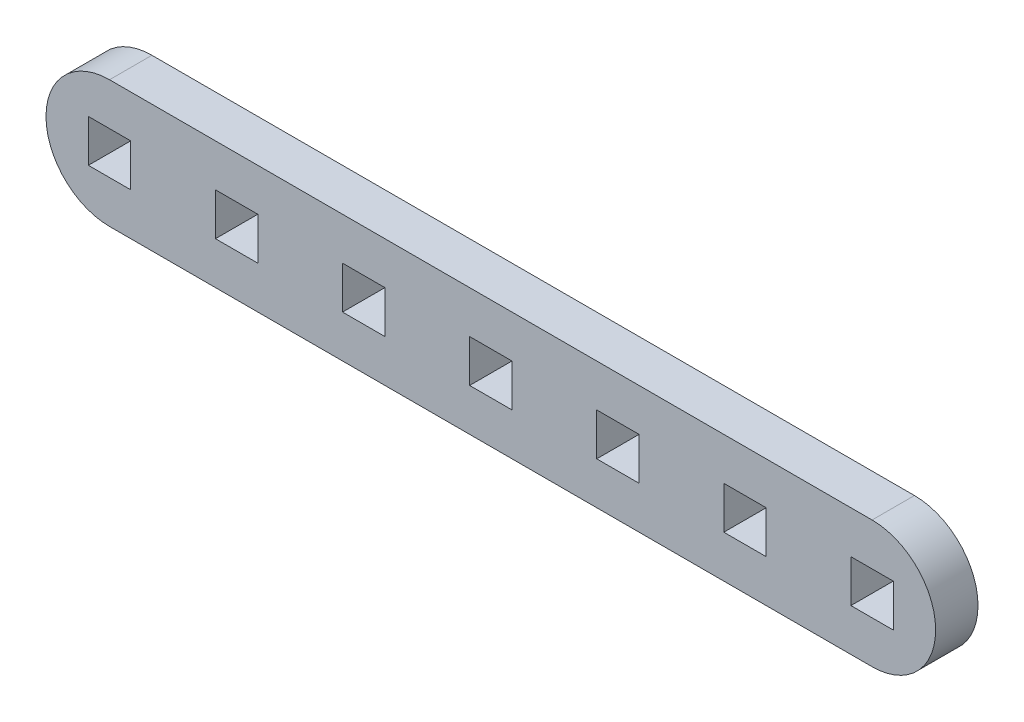
from build123d import *

# Parameters (mm, degrees)
MODEL_W                 = 3
MODEL_H                 = 3
SALIENTE_EXTRUIR1_DEPTH = 3


with BuildPart() as part:
    # Model → Saliente-Extruir1 (new body)
    with BuildSketch(Plane.XY):
        with BuildLine():
            Line((11.870836217, 297.491184957), (65.870836217, 297.491184957))
            ThreePointArc((65.870836217, 297.491184957), (70.370836217, 292.991184957), (65.870836217, 288.491184957))
            Line((65.870836217, 288.491184957), (11.870836217, 288.491184957))
            ThreePointArc((11.870836217, 288.491184957), (7.370836217, 292.991184957), (11.870836217, 297.491184957))
        make_face()
        with Locations((11.870836217, 292.991184957)):
            Rectangle(MODEL_W, MODEL_H, mode=Mode.SUBTRACT)
        with Locations((20.870836217, 292.991184957)):
            Rectangle(MODEL_W, MODEL_H, mode=Mode.SUBTRACT)
        with Locations((29.870836217, 292.991184957)):
            Rectangle(MODEL_W, MODEL_H, mode=Mode.SUBTRACT)
        with Locations((38.870836217, 292.991184957)):
            Rectangle(MODEL_W, MODEL_H, mode=Mode.SUBTRACT)
        with Locations((47.870836217, 292.991184957)):
            Rectangle(MODEL_W, MODEL_H, mode=Mode.SUBTRACT)
        with Locations((56.870836217, 292.991184957)):
            Rectangle(MODEL_W, MODEL_H, mode=Mode.SUBTRACT)
        with Locations((65.870836217, 292.991184957)):
            Rectangle(MODEL_W, MODEL_H, mode=Mode.SUBTRACT)
    extrude(amount=SALIENTE_EXTRUIR1_DEPTH)


solid = part.part
